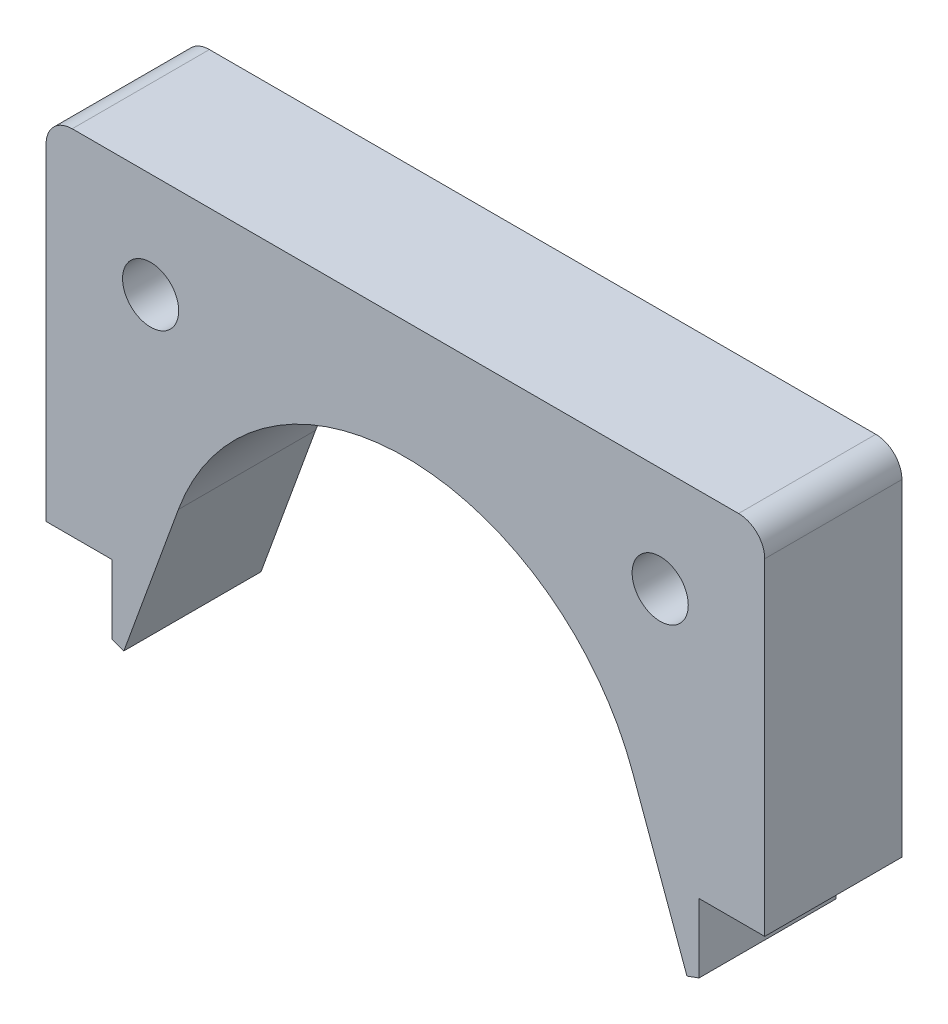
from build123d import *

# Parameters (mm, degrees)
SKETCH1_R           = 2.15
BOSS_EXTRUDE1_DEPTH = 10.5
FILLET1_R           = 2


with BuildPart() as part:
    # Sketch1 → Boss-Extrude1 (new body)
    with BuildSketch(Plane.XY):
        with BuildLine():
            Line((13.944137731, -26.361003887), (14.869335388, -26.697748295))
            Line((14.869335388, -26.697748295), (19.041515783, -15.234776871))
            ThreePointArc((19.041515783, -15.234776871), (36.418598187, -3.067212779), (53.795680592, -15.234776871))
            Line((53.795680592, -15.234776871), (57.967860986, -26.697748295))
            Line((57.967860986, -26.697748295), (58.893058643, -26.361003887))
            Line((58.893058643, -26.361003887), (58.893058643, -21.090651307))
            Line((58.893058643, -21.090651307), (63.918598187, -21.090651307))
            Line((63.918598187, -21.090651307), (63.918598187, 5.940482376))
            Line((63.918598187, 5.940482376), (8.918598187, 5.940482376))
            Line((8.918598187, 5.940482376), (8.918598187, -21.090651307))
            Line((8.918598187, -21.090651307), (13.944137731, -21.090651307))
            Line((13.944137731, -21.090651307), (13.944137731, -26.361003887))
        make_face()
        with Locations((55.918598187, -2.059517624)):
            Circle(SKETCH1_R, mode=Mode.SUBTRACT)
        with Locations((16.918598187, -2.059517624)):
            Circle(SKETCH1_R, mode=Mode.SUBTRACT)
    extrude(amount=BOSS_EXTRUDE1_DEPTH)

    # Fillet1
    fillet1_edges = [part.edges().sort_by_distance(p)[0] for p in [
        (8.918598187, 5.940482376, 5.25),
        (63.918598187, 5.940482376, 5.25),
    ]]
    fillet(fillet1_edges, radius=FILLET1_R)


solid = part.part
